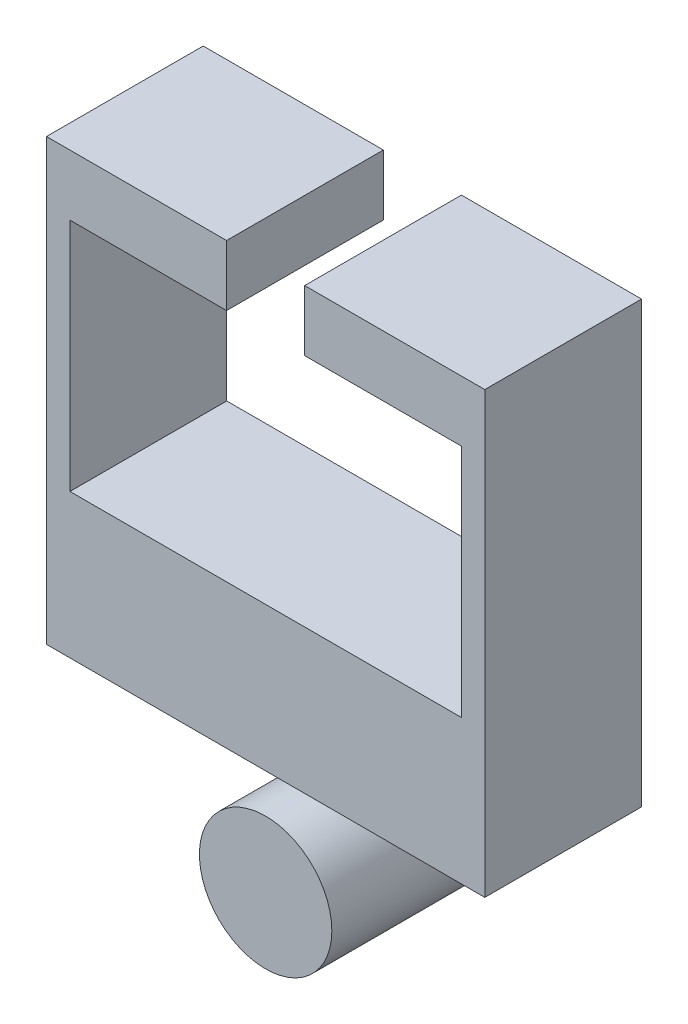
from build123d import *

# Parameters (mm, degrees)
SKETCH1_R             = 10.728678925
BOSS_EXTRUDE1_DEPTH   = 25.4
BOSS_EXTRUDE1_2_DEPTH = 25.4
SKETCH2_W             = 21.45735785
SKETCH2_H             = 4.041014957
BOSS_EXTRUDE2_DEPTH   = 17.0688


with BuildPart() as part:
    # Sketch1 → Boss-Extrude1 (new body)
    with BuildSketch(Plane.XY):
        Circle(SKETCH1_R)
    extrude(amount=BOSS_EXTRUDE1_DEPTH)



with BuildPart() as body_2:
    # Sketch1 → Boss-Extrude1 2 (new body)
    with BuildSketch(Plane.XY):
        Polygon((-35.51174, 17.0688), (35.51174, 17.0688), (35.51174, 88.336755193), (6.3246, 88.336755193), (6.3246, 78.503313232), (31.70428, 78.503313232), (31.70428, 40.428713232), (-31.70428, 40.428713232), (-31.70428, 78.503313232), (-6.3246, 78.503313232), (-6.3246, 88.336755193), (-35.51174, 88.336755193), align=None)
    extrude(amount=BOSS_EXTRUDE1_2_DEPTH)


with BuildPart() as part_1:
    add(part.part)

    add(body_2.part)  # Boss-Extrude2 merges body 2
    # Sketch2 → Boss-Extrude2 (add)
    with BuildSketch(Plane.XZ.offset(-17.0688)):
        with Locations((0, 2.020507479)):
            Rectangle(SKETCH2_W, SKETCH2_H)
    extrude(amount=BOSS_EXTRUDE2_DEPTH)


solid = part_1.part
